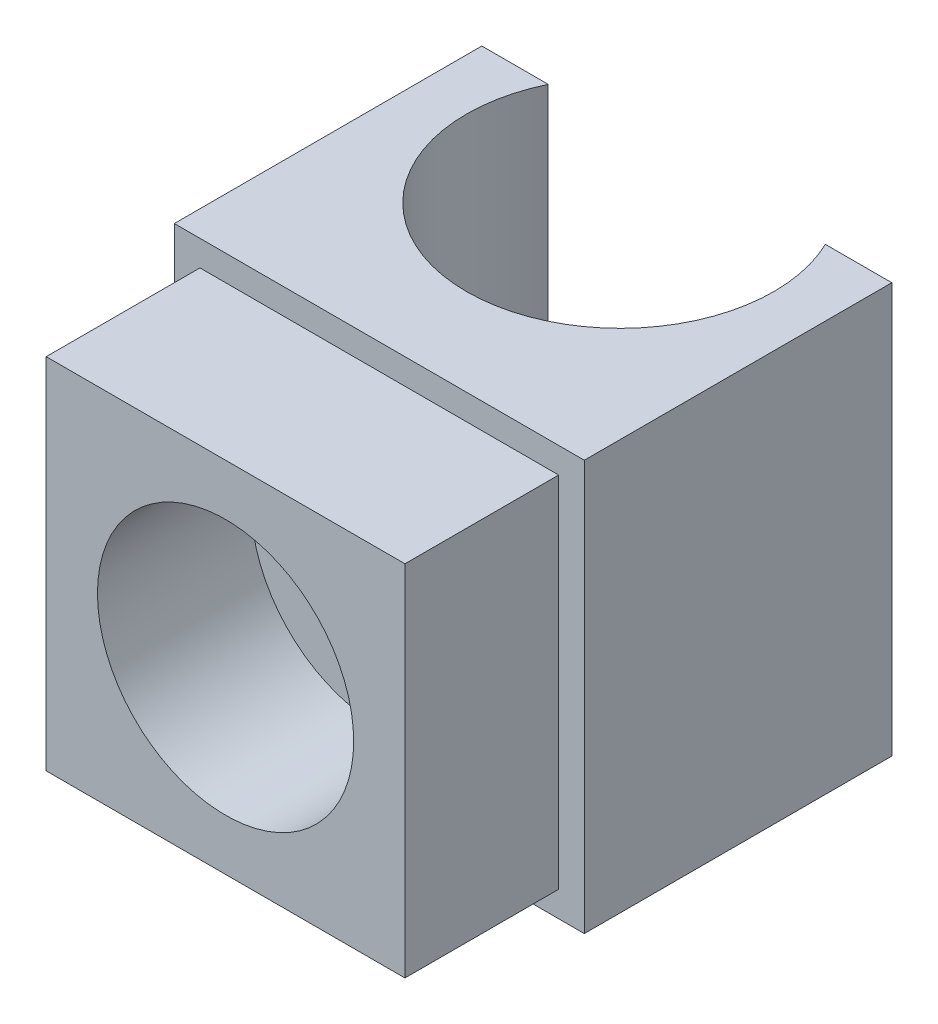
from build123d import *

# Parameters (mm, degrees)
SALIENTE_EXTRUIR1_DEPTH      = 40
SALIENTE_EXTRUIR1_DEPTH_BACK = 40
CROQUIS2_W                   = 70
CROQUIS2_H                   = 70
SALIENTE_EXTRUIR2_DEPTH      = 30
CROQUIS3_R                   = 25
CORTAR_EXTRUIR1_DEPTH        = 30


with BuildPart() as part:
    # Croquis1 → Saliente-Extruir1 (new, two sides: drawn at the far end of the back side and taken through both)
    with BuildSketch(Plane(origin=(0, 0, 0), x_dir=(1, 0, 0), z_dir=(0, 1, 0)).offset(-SALIENTE_EXTRUIR1_DEPTH_BACK)):
        with BuildLine():
            Line((-40, 13), (-27.037011669, 13))
            ThreePointArc((-27.037011669, 13), (0, -30), (27.037011669, 13))
            Line((27.037011669, 13), (40, 13))
            Line((40, 13), (40, -47))
            Line((40, -47), (-40, -47))
            Line((-40, -47), (-40, 13))
        make_face()
    extrude(amount=SALIENTE_EXTRUIR1_DEPTH + SALIENTE_EXTRUIR1_DEPTH_BACK)

    # Croquis2 → Saliente-Extruir2 (add)
    with BuildSketch(Plane.XY.offset(47)):
        Rectangle(CROQUIS2_W, CROQUIS2_H)
    extrude(amount=SALIENTE_EXTRUIR2_DEPTH)

    # Croquis3 → Cortar-Extruir1 (cut)
    with BuildSketch(Plane.XY.offset(77)):
        Circle(CROQUIS3_R)
    extrude(amount=-CORTAR_EXTRUIR1_DEPTH, mode=Mode.SUBTRACT)


solid = part.part
